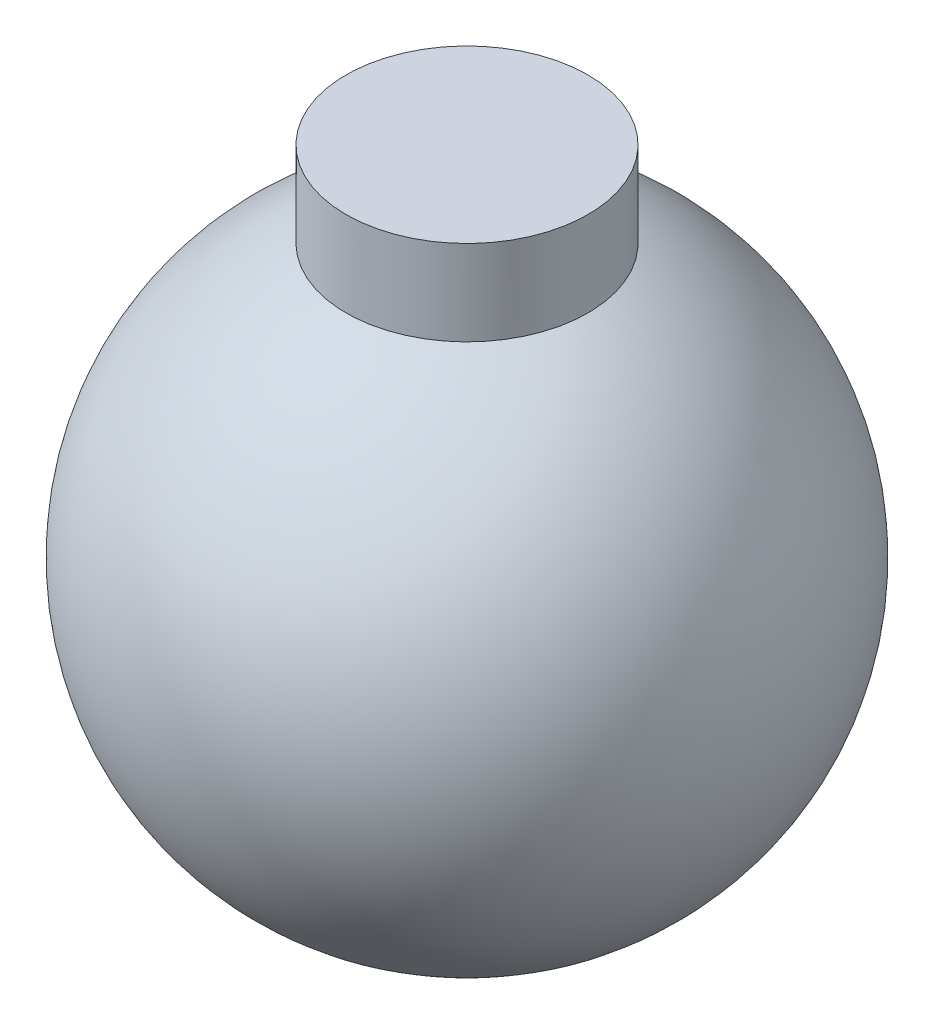
from build123d import *

# Parameters (mm, degrees)
SKETCH_2_R      = 10.160580838
EXTRUDE_1_DEPTH = 30


with BuildPart() as part:
    # 草图1 → 旋转1 (revolve)
    with BuildSketch(Plane(origin=(0, 0, 0), x_dir=(1, 0, 0), z_dir=(0, 1, 0))):
        with BuildLine():
            Line((0, 25), (0, -25))
            ThreePointArc((0, -25), (25, 0), (0, 25))
        make_face()
    revolve(axis=Axis((0, 0, 25), (0, 0, -1)))

    # 草图2 → 凸台-拉伸1 (add)
    with BuildSketch(Plane(origin=(0, 0, 0), x_dir=(1, 0, 0), z_dir=(0, 1, 0))):
        with Locations(Location((0, 0, 0), (0, 0, 90))):
            Circle(SKETCH_2_R)
    extrude(amount=EXTRUDE_1_DEPTH)


solid = part.part
